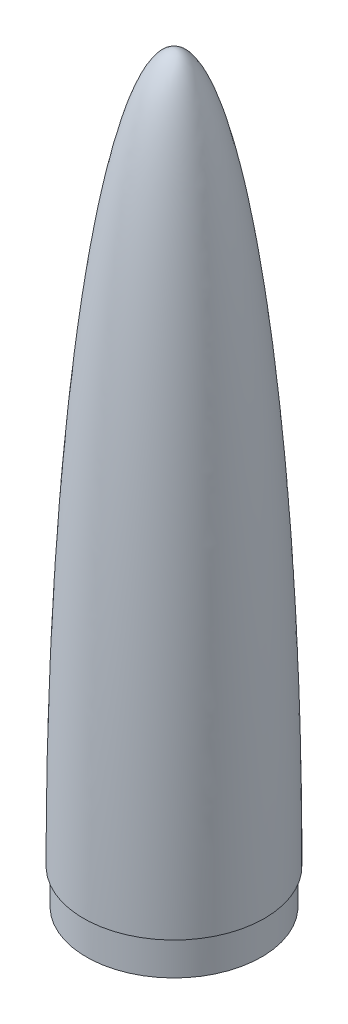
from build123d import *


with BuildPart() as part:
    # Croquis1 → Revolución1 (revolve)
    with BuildSketch(Plane.XY):
        with BuildLine():
            add(Edge.make_bspline(
                [(37.79, 0), (37.79, 9.960236444), (37.664694442, 29.935572546), (37.102655042, 59.565861984), (36.171920492, 88.633245112), (34.451616706, 126.246412144), (31.431973521, 170.440975848), (26.556684844, 216.90935024), (21.609420408, 248.663260812), (17.240887319, 269.142472583), (13.795202072, 281.88820718), (10.223461032, 291.880973096), (7.191615394, 297.807361864), (4.801622063, 301.042747952), (3.071446776, 302.705487017), (1.448432646, 303.619825673), (0.50343541, 303.8), (0, 303.8)],
                knots=[-1.570796327, -1.570796327, -1.570796327, -1.570796327, -1.472621556, -1.374446786, -1.276272016, -1.178097245, -0.981747704, -0.785398163, -0.589048623, -0.490873852, -0.392699082, -0.294524311, -0.196349541, -0.147262156, -0.09817477, -0.049087385, 0, 0, 0, 0], degree=3))
            Line((0, 303.8), (0, 305))
            add(Edge.make_bspline(
                [(38.99, 0), (38.99, 305), (0, 305)],
                knots=[4.71238898, 4.71238898, 4.71238898, 6.283185307, 6.283185307, 6.283185307], degree=2, weights=[1, 0.707106781, 1]))
            Line((38.99, 0), (37.79, 0))
        make_face()
    revolve(axis=Axis((0, 0, 0), (0, 1, 0)))

    # Sketch1 → Revolve1 (revolve)
    with BuildSketch(Plane.XY, mode=Mode.PRIVATE) as revolve1_sk:
        Polygon((37.79, 0), (37.79, -15), (36.29, -15), (36.29, 0), (36.29, 1.5), (37.79, 3), (37.79, 1.5), align=None)
    revolve(revolve1_sk.sketch.rotate(Axis((0, 0, 0), (0, 1, 0)), 90), axis=Axis((0, 0, 0), (0, 1, 0)))


solid = part.part
